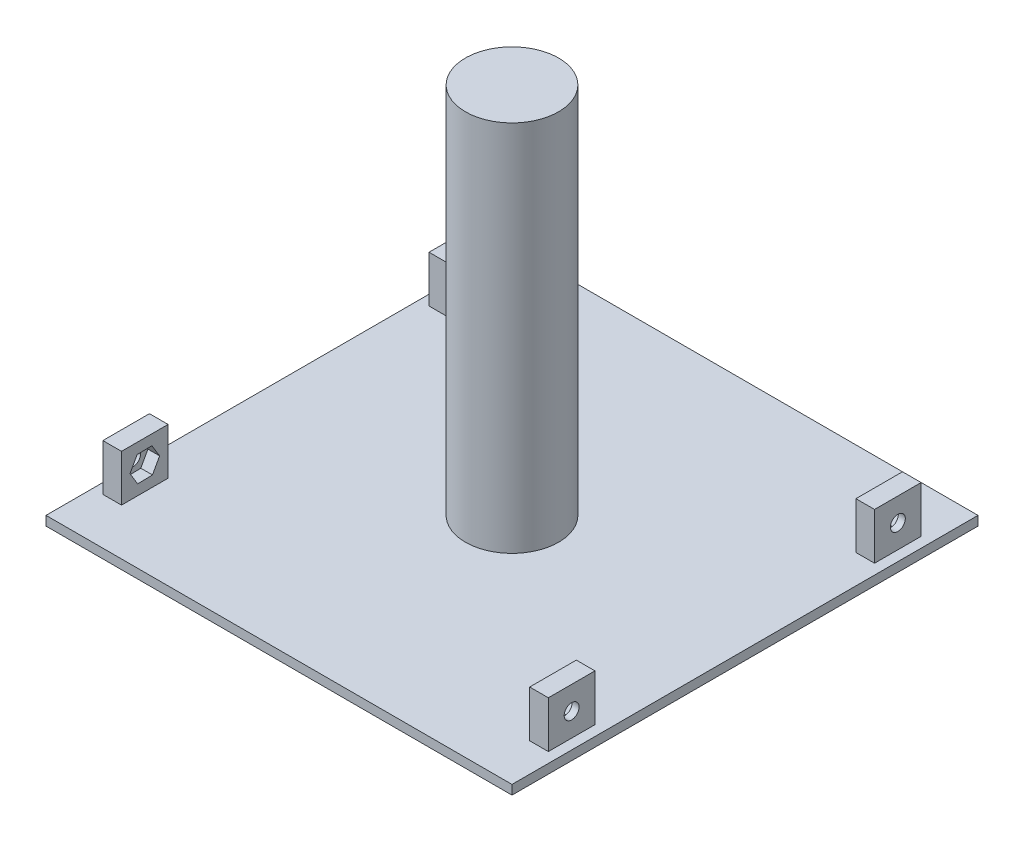
from build123d import *

# Parameters (mm, degrees)
IZIM1_W                     = 100
IZIM1_H                     = 100
Y_KSEKLIK_EKSTR_ZYON1_DEPTH = 2
IZIM2_R                     = 10
Y_KSEKLIK_EKSTR_ZYON2_DEPTH = 80
IZIM3_W                     = 4
IZIM3_H                     = 10
Y_KSEKLIK_EKSTR_ZYON3_DEPTH = 10
KES_EKSTR_ZYON1_DEPTH       = 2.5
IZIM6_R                     = 1.6
KES_EKSTR_ZYON2_DEPTH       = 5
KES_EKSTR_ZYON3_DEPTH       = 2.5
KES_EKSTR_ZYON4_START       = -5
IZIM8_R                     = 1.6
KES_EKSTR_ZYON4_DEPTH       = 5


with BuildPart() as part:
    # Çizim1 → Yükseklik-Ekstrüzyon1 (new body)
    with BuildSketch(Plane(origin=(0, 0, 0), x_dir=(1, 0, 0), z_dir=(0, 1, 0))):
        Rectangle(IZIM1_W, IZIM1_H)
    extrude(amount=Y_KSEKLIK_EKSTR_ZYON1_DEPTH)

    # Çizim2 → Yükseklik-Ekstrüzyon2 (add)
    with BuildSketch(Plane(origin=(0, 2, 0), x_dir=(1, 0, 0), z_dir=(0, 1, 0))):
        with Locations(Location((0, 0, 0), (0, 0, 270))):
            Circle(IZIM2_R)
    extrude(amount=Y_KSEKLIK_EKSTR_ZYON2_DEPTH)

    # Çizim3 → Yükseklik-Ekstrüzyon3 (add)
    with BuildSketch(Plane(origin=(0, 2, 0), x_dir=(1, 0, 0), z_dir=(0, 1, 0))):
        with Locations((-45.8, 35)):
            Rectangle(IZIM3_W, IZIM3_H)
        with Locations((45.8, 35)):
            Rectangle(IZIM3_W, IZIM3_H)
        with Locations((-45.8, -35)):
            Rectangle(IZIM3_W, IZIM3_H)
        with Locations((45.8, -35)):
            Rectangle(IZIM3_W, IZIM3_H)
    extrude(amount=Y_KSEKLIK_EKSTR_ZYON3_DEPTH)

    # Çizim5 → Kes-Ekstrüzyon1 (cut)
    with BuildSketch(Plane(origin=(-43.8, 0, 0), x_dir=(0, 0, -1), z_dir=(1, 0, 0))):
        Polygon((-36.526149852, 4.215363585), (-33.35150905, 4.285997251), (-31.825359198, 7.070633666), (-33.473850148, 9.784636415), (-36.64849095, 9.714002749), (-38.174640802, 6.929366334), align=None)
        Polygon((33.473850148, 4.215363585), (36.64849095, 4.285997251), (38.174640802, 7.070633666), (36.526149852, 9.784636415), (33.35150905, 9.714002749), (31.825359198, 6.929366334), align=None)
    extrude(amount=-KES_EKSTR_ZYON1_DEPTH, mode=Mode.SUBTRACT)

    # Çizim6 → Kes-Ekstrüzyon2 (cut)
    with BuildSketch(Plane(origin=(-43.8, 0, 0), x_dir=(0, 0, -1), z_dir=(1, 0, 0))):
        with Locations((-35, 7)):
            Circle(IZIM6_R)
        with Locations((35, 7)):
            Circle(IZIM6_R)
    extrude(amount=-KES_EKSTR_ZYON2_DEPTH, mode=Mode.SUBTRACT)

    # Çizim7 → Kes-Ekstrüzyon3 (cut)
    with BuildSketch(Plane.ZY.offset(-43.8)):
        Polygon((-33.475734775, 9.785668476), (-36.650327054, 9.712886645), (-38.174592279, 6.927218169), (-36.524265225, 4.214331524), (-33.349672946, 4.287113355), (-31.825407721, 7.072781831), align=None)
        Polygon((36.524265225, 9.785668476), (33.349672946, 9.712886645), (31.825407721, 6.927218169), (33.475734775, 4.214331524), (36.650327054, 4.287113355), (38.174592279, 7.072781831), align=None)
    extrude(amount=-KES_EKSTR_ZYON3_DEPTH, mode=Mode.SUBTRACT)

    # Çizim8 → Kes-Ekstrüzyon4 (cut)
    with BuildSketch(Plane.ZY.offset(-43.8).offset(KES_EKSTR_ZYON4_START)):
        with Locations(Location((35, 7, 0), (0, 0, 180))):
            Circle(IZIM8_R)
        with Locations(Location((-35, 7, 0), (0, 0, 180))):
            Circle(IZIM8_R)
    extrude(amount=KES_EKSTR_ZYON4_DEPTH, mode=Mode.SUBTRACT)


solid = part.part
